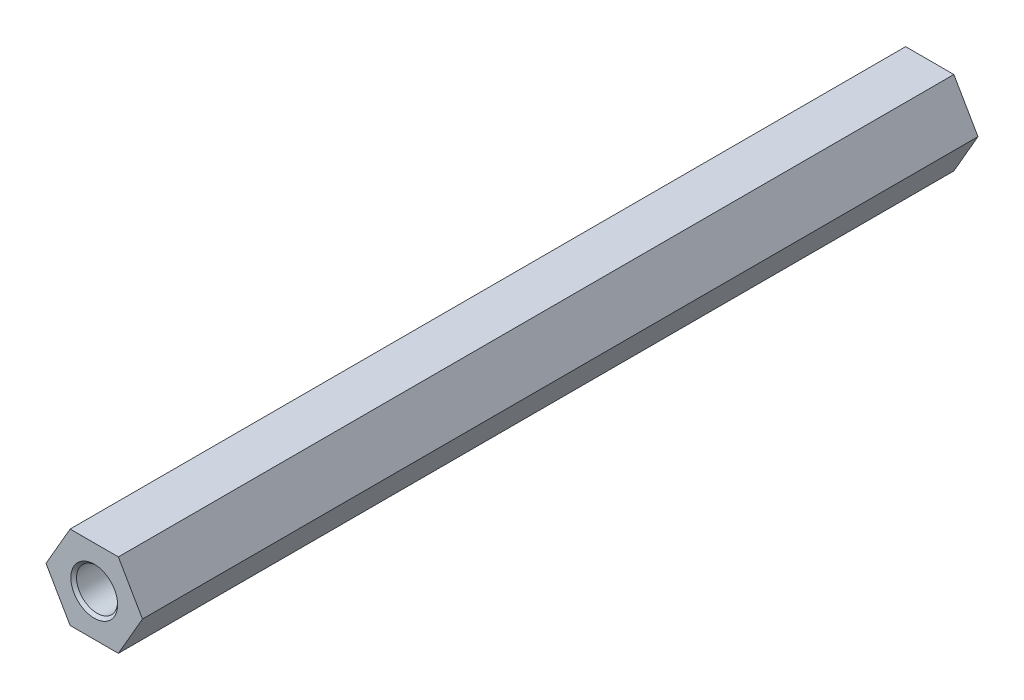
from build123d import *
from OCP.BRepFilletAPI import BRepFilletAPI_MakeChamfer

# Parameters (mm, degrees)
BOSS_EXTRUDE1_DEPTH      = 50
M2_CLEARANCE_HOLE1_D     = 2.459
M2_CLEARANCE_HOLE1_DEPTH = 11
M2_CLEARANCE_HOLE1_TIP   = 0.738758131
M2_CLEARANCE_HOLE2_D     = 2.459
M2_CLEARANCE_HOLE2_DEPTH = 11
M2_CLEARANCE_HOLE2_TIP   = 0.738758131
CHAMFER1_SIZE            = 0.000231998
CHAMFER1_SIZE2           = 0.000133944
CHAMFER2_SIZE            = 0.1705


with BuildPart() as part:
    # Sketch1 → Boss-Extrude1 (new body)
    with BuildSketch(Plane.XY.offset(25)):
        Polygon((-1.443375673, -2.5), (1.443375673, -2.5), (2.886751346, 0), (1.443375673, 2.5), (-1.443375673, 2.5), (-2.886751346, 0), align=None)
    extrude(amount=-BOSS_EXTRUDE1_DEPTH)

    # M2 Clearance Hole1
    with Locations(Plane(origin=(0, 0, -25), x_dir=(-1, 0, 0), z_dir=(0, 0, -1))):
        with Locations((0, 0)):
            Hole(M2_CLEARANCE_HOLE1_D / 2, depth=M2_CLEARANCE_HOLE1_DEPTH)
            with Locations((0, 0, -(M2_CLEARANCE_HOLE1_DEPTH + M2_CLEARANCE_HOLE1_TIP / 2))):  # 118° drill point
                Cone(0, M2_CLEARANCE_HOLE1_D / 2, M2_CLEARANCE_HOLE1_TIP, mode=Mode.SUBTRACT)

    # M2 Clearance Hole2
    with Locations(Plane.XY.offset(25)):
        with Locations((0, 0)):
            Hole(M2_CLEARANCE_HOLE2_D / 2, depth=M2_CLEARANCE_HOLE2_DEPTH)
            with Locations((0, 0, -(M2_CLEARANCE_HOLE2_DEPTH + M2_CLEARANCE_HOLE2_TIP / 2))):  # 118° drill point
                Cone(0, M2_CLEARANCE_HOLE2_D / 2, M2_CLEARANCE_HOLE2_TIP, mode=Mode.SUBTRACT)

    # Chamfer1: one chamfer whose edges measure the first distance from different faces: ONE call of the kernel's chamfer builder (chamfer() names one face for all edges)
    chamfer1_edges_1 = [part.edges().sort_by_distance(p)[0] for p in [
        (2.165063509, -1.25, -25),
        (2.165063509, 1.25, -25),
        (0, 2.5, -25),
        (-2.165063509, 1.25, -25),
        (-2.165063509, -1.25, -25),
        (0, -2.5, -25),
    ]]
    chamfer1_side_1 = [part.faces().sort_by_distance(p)[0] for p in [
        (0, -2.423623738, -25),
    ]]
    chamfer1_edges_2 = [part.edges().sort_by_distance(p)[0] for p in [
        (-2.165063509, 1.25, 25),
    ]]
    chamfer1_side_2 = [part.faces().sort_by_distance(p)[0] for p in [
        (-2.165063509, 1.25, 0),
    ]]
    chamfer1_edges_3 = [part.edges().sort_by_distance(p)[0] for p in [
        (0, 2.5, 25),
    ]]
    chamfer1_side_3 = [part.faces().sort_by_distance(p)[0] for p in [
        (0, 2.5, 0),
    ]]
    chamfer1_edges_4 = [part.edges().sort_by_distance(p)[0] for p in [
        (2.165063509, 1.25, 25),
    ]]
    chamfer1_side_4 = [part.faces().sort_by_distance(p)[0] for p in [
        (2.165063509, 1.25, 0),
    ]]
    chamfer1_edges_5 = [part.edges().sort_by_distance(p)[0] for p in [
        (2.165063509, -1.25, 25),
    ]]
    chamfer1_side_5 = [part.faces().sort_by_distance(p)[0] for p in [
        (2.165063509, -1.25, 0),
    ]]
    chamfer1_edges_6 = [part.edges().sort_by_distance(p)[0] for p in [
        (0, -2.5, 25),
    ]]
    chamfer1_side_6 = [part.faces().sort_by_distance(p)[0] for p in [
        (0, -2.5, 0),
    ]]
    chamfer1_edges_7 = [part.edges().sort_by_distance(p)[0] for p in [
        (-2.165063509, -1.25, 25),
    ]]
    chamfer1_side_7 = [part.faces().sort_by_distance(p)[0] for p in [
        (-2.165063509, -1.25, 0),
    ]]
    chamfer1 = BRepFilletAPI_MakeChamfer(part.part.solid().wrapped)
    for e in chamfer1_edges_1:
        chamfer1.Add(CHAMFER1_SIZE, CHAMFER1_SIZE2, e.wrapped, chamfer1_side_1[0].wrapped)  # the first distance lies on this face
    for e in chamfer1_edges_2:
        chamfer1.Add(CHAMFER1_SIZE, CHAMFER1_SIZE2, e.wrapped, chamfer1_side_2[0].wrapped)  # the first distance lies on this face
    for e in chamfer1_edges_3:
        chamfer1.Add(CHAMFER1_SIZE, CHAMFER1_SIZE2, e.wrapped, chamfer1_side_3[0].wrapped)  # the first distance lies on this face
    for e in chamfer1_edges_4:
        chamfer1.Add(CHAMFER1_SIZE, CHAMFER1_SIZE2, e.wrapped, chamfer1_side_4[0].wrapped)  # the first distance lies on this face
    for e in chamfer1_edges_5:
        chamfer1.Add(CHAMFER1_SIZE, CHAMFER1_SIZE2, e.wrapped, chamfer1_side_5[0].wrapped)  # the first distance lies on this face
    for e in chamfer1_edges_6:
        chamfer1.Add(CHAMFER1_SIZE, CHAMFER1_SIZE2, e.wrapped, chamfer1_side_6[0].wrapped)  # the first distance lies on this face
    for e in chamfer1_edges_7:
        chamfer1.Add(CHAMFER1_SIZE, CHAMFER1_SIZE2, e.wrapped, chamfer1_side_7[0].wrapped)  # the first distance lies on this face
    add(Compound.cast(chamfer1.Shape()), mode=Mode.REPLACE)

    # Chamfer2
    chamfer2_edges = [part.edges().sort_by_distance(p)[0] for p in [
        (-1.2295, 0, -25),
        (1.2295, 0, 25),
    ]]
    chamfer(chamfer2_edges, length=CHAMFER2_SIZE)


solid = part.part
